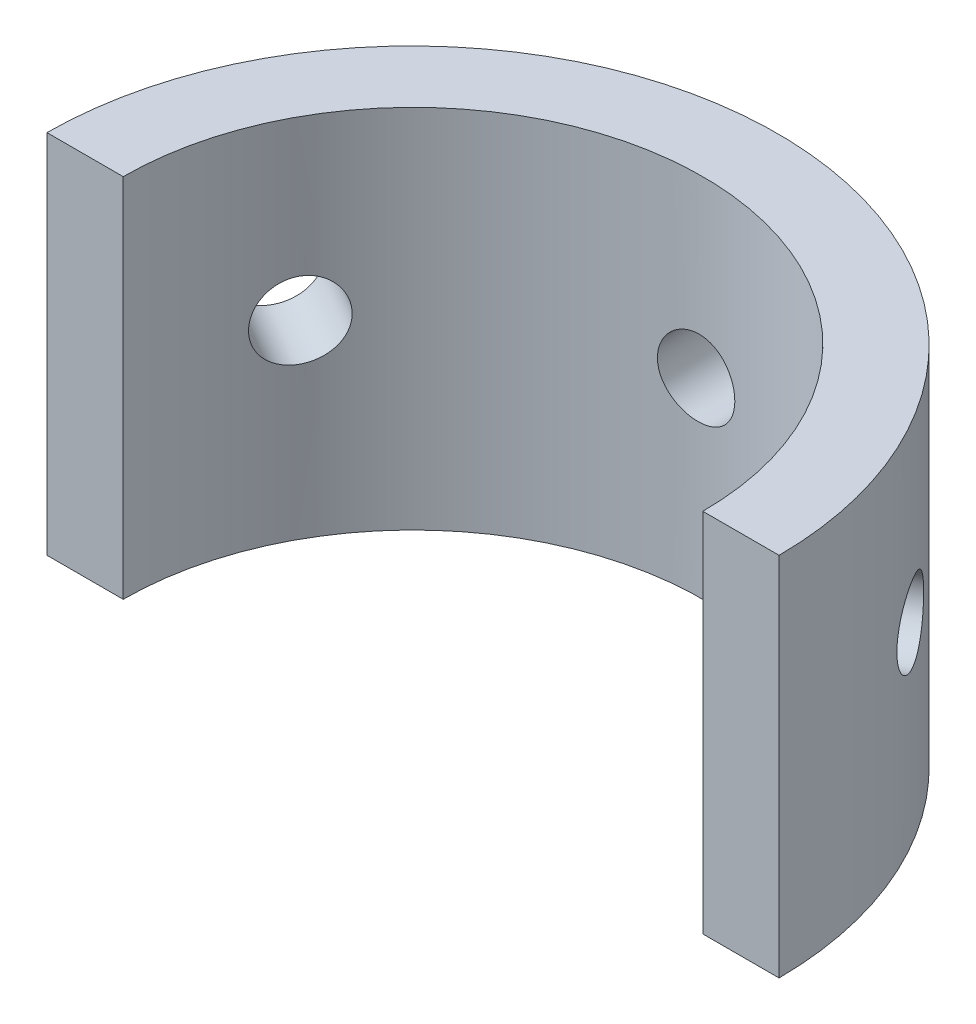
from build123d import *

# Parameters (mm, degrees)
BOSS_EXTRUDE1_DEPTH = 30.48
SKETCH3_R           = 24.13
CUT_EXTRUDE4_DEPTH  = 90.914560616
SKETCH4_R           = 3.175
CUT_EXTRUDE5_DEPTH  = 63.754
CIRPATTERN3_COUNT   = 6


with BuildPart() as part:
    # Sketch1 → Boss-Extrude1 (new body)
    with BuildSketch(Plane(origin=(0, 0, 0), x_dir=(1, 0, 0), z_dir=(0, 1, 0))):
        with BuildLine():
            Line((-78.958715675, 0), (-17.998715675, 0))
            ThreePointArc((-17.998715675, 0), (-48.478715675, 30.349942827), (-78.958715675, 0))
        make_face()
    extrude(amount=BOSS_EXTRUDE1_DEPTH)

    # Sketch3 → Cut-Extrude4 (cut, through all)
    with BuildSketch(Plane(origin=(0, 0, 0), x_dir=(1, 0, 0), z_dir=(0, 1, 0))):
        with Locations((-48.478715675, 0)):
            Circle(SKETCH3_R)
    extrude(amount=CUT_EXTRUDE4_DEPTH, mode=Mode.SUBTRACT)

    # Sketch4 → Cut-Extrude5 (cut)
    with BuildSketch(Plane.XY):
        with Locations((-48.824364134, 15.798935299)):
            Circle(SKETCH4_R)
    cut_extrude5 = extrude(amount=-CUT_EXTRUDE5_DEPTH, mode=Mode.SUBTRACT)

    # CirPattern3: Cut-Extrude5 ×6 about axis
    cirpattern3_axis = Axis((-48.478715675, 30.48, 0.130335837), (0, -1, 0))
    for i in range(1, CIRPATTERN3_COUNT):
        add(cut_extrude5.rotate(cirpattern3_axis, i * 360 / CIRPATTERN3_COUNT), mode=Mode.SUBTRACT)


solid = part.part
